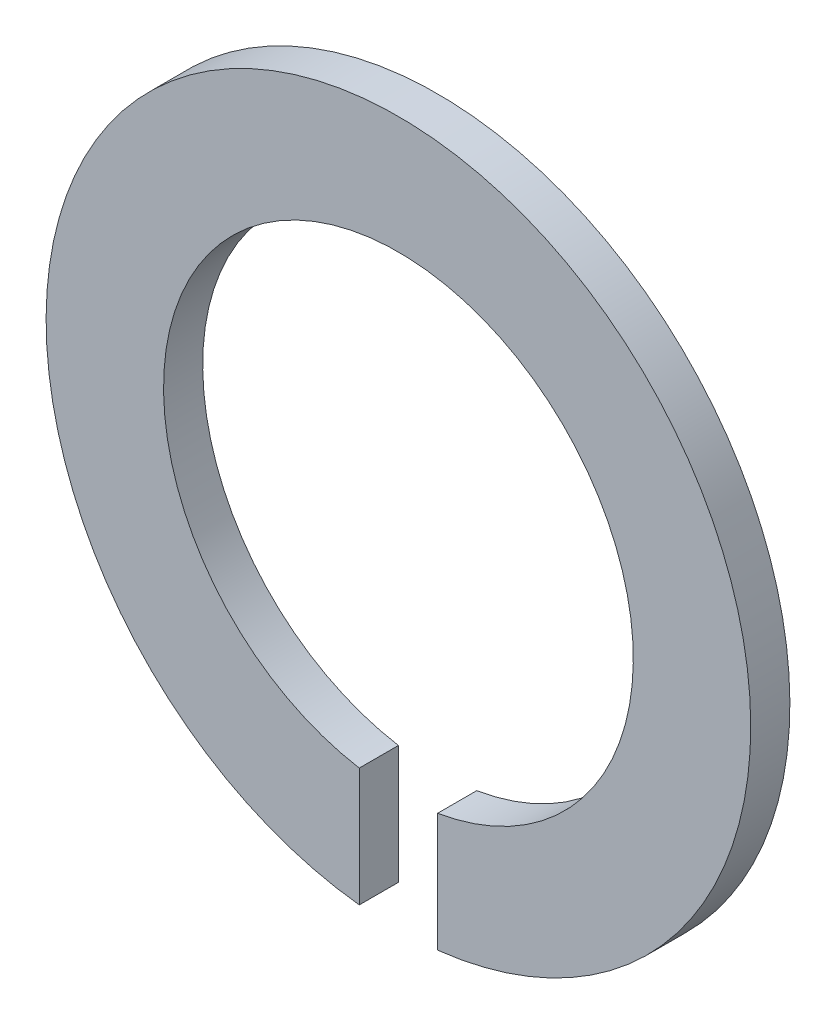
from build123d import *

# Parameters (mm, degrees)
BOSS_EXTRU_1_DEPTH = 0.5


with BuildPart() as part:
    # Esquisse2 → Boss.-Extru.1 (new body)
    with BuildSketch(Plane.XY):
        with BuildLine():
            Line((0.5, -4.472135955), (0.5, -2.958039892))
            ThreePointArc((0.5, -2.958039892), (0, 3), (-0.5, -2.958039892))
            Line((-0.5, -2.958039892), (-0.5, -4.472135955))
            ThreePointArc((-0.5, -4.472135955), (0, 4.5), (0.5, -4.472135955))
        make_face()
    extrude(amount=BOSS_EXTRU_1_DEPTH)


solid = part.part
